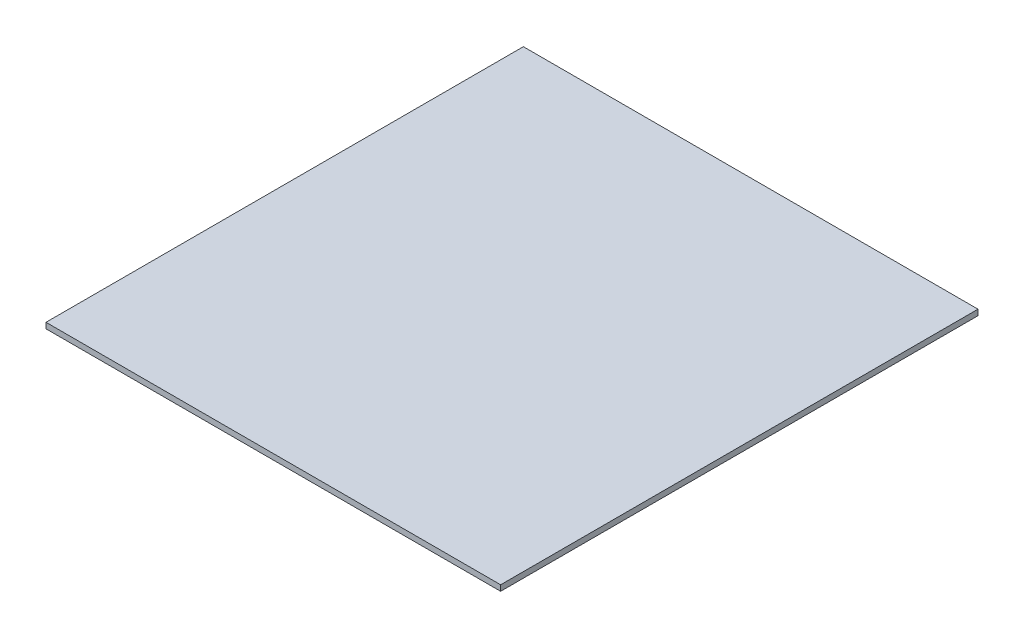
from build123d import *

# Parameters (mm, degrees)
SKETCH1_W           = 508
SKETCH1_H           = 533.4
BOSS_EXTRUDE1_DEPTH = 6.35


with BuildPart() as part:
    # Sketch1 → Boss-Extrude1 (new body)
    with BuildSketch(Plane(origin=(0, 0, 0), x_dir=(1, 0, 0), z_dir=(0, 1, 0))):
        Rectangle(SKETCH1_W, SKETCH1_H)
    extrude(amount=BOSS_EXTRUDE1_DEPTH)


solid = part.part
